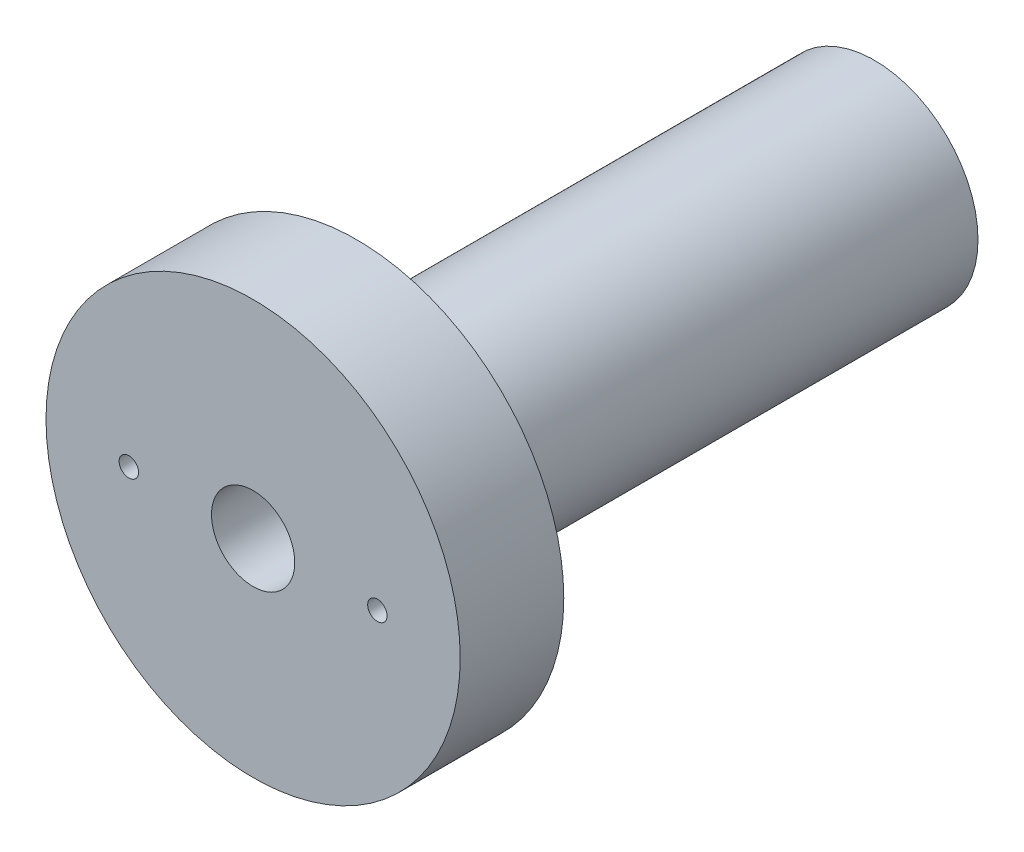
from build123d import *

# Parameters (mm, degrees)
SKETCH1_R               = 6.35
SKETCH1_R_2             = 2.5527
BOSS_EXTRUDE1_DEPTH     = 31.75
SKETCH2_R               = 12.7
SKETCH2_R_2             = 2.5527
BOSS_EXTRUDE2_DEPTH     = 6.35
SKETCH3_R               = 0.5953125
CUT_EXTRUDE1_DEPTH      = 43.121134838
BOSS_EXTRUDE3_START     = -38.1
SKETCH11_R              = 2.5527
BOSS_EXTRUDE3_DEPTH     = 38.1
F_1_4_20_TAPPED_HOLE3_D = 5.1054


with BuildPart() as part:
    # Sketch1 → Boss-Extrude1 (new body)
    with BuildSketch(Plane.XY):
        Circle(SKETCH1_R)
        Circle(SKETCH1_R_2, mode=Mode.SUBTRACT)
    extrude(amount=BOSS_EXTRUDE1_DEPTH)

    # Sketch2 → Boss-Extrude2 (add)
    with BuildSketch(Plane.XY.offset(31.75)):
        Circle(SKETCH2_R)
        Circle(SKETCH2_R_2, mode=Mode.SUBTRACT)
    extrude(amount=BOSS_EXTRUDE2_DEPTH)

    # Sketch3 → Cut-Extrude1 (cut, through all)
    with BuildSketch(Plane.XY.offset(38.1)):
        with Locations((-7.62, 0)):
            Circle(SKETCH3_R)
        with Locations((7.62, 0)):
            Circle(SKETCH3_R)
    extrude(amount=-CUT_EXTRUDE1_DEPTH, mode=Mode.SUBTRACT)

    # Sketch11 → Boss-Extrude3 (add)
    with BuildSketch(Plane.XY.offset(38.1).offset(BOSS_EXTRUDE3_START)):
        Circle(SKETCH11_R)
    extrude(amount=BOSS_EXTRUDE3_DEPTH)

    # 1/4-20 Tapped Hole3 (through all)
    with Locations(Plane.XY.offset(38.1)):
        with Locations((0, 0)):
            Hole(F_1_4_20_TAPPED_HOLE3_D / 2)


solid = part.part
